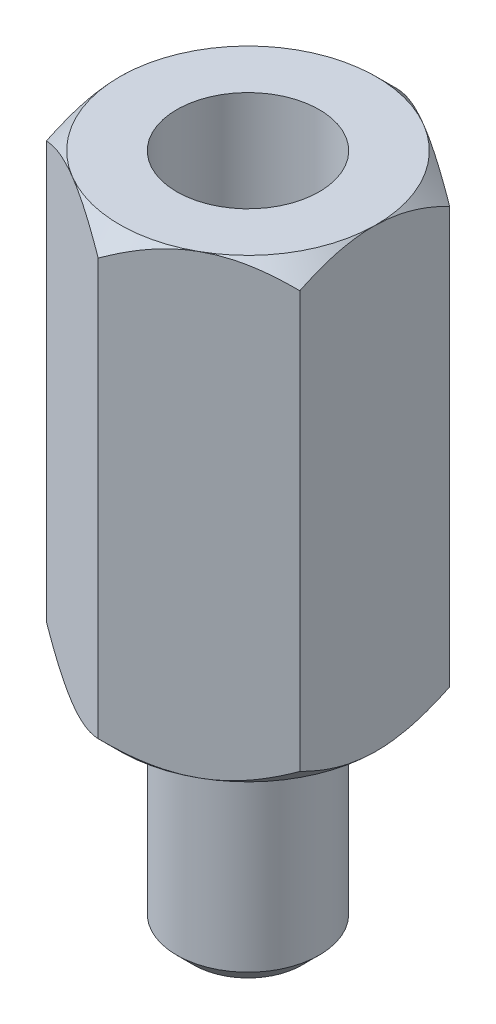
from build123d import *

# Parameters (mm, degrees)
SKETCH1_R           = 1.25
BOSS_EXTRUDE1_DEPTH = 3.9
BOSS_EXTRUDE2_DEPTH = 8
CUT_EXTRUDE1_START  = -4.8
SKETCH3_R           = 1.25
CUT_EXTRUDE1_DEPTH  = 4.8
SKETCH5_OUTSIDE_W   = 36.058
SKETCH5_OUTSIDE_H   = 36.724
SKETCH5_OUTSIDE_R   = 2.25
CUT_EXTRUDE2_DEPTH  = 13.389058311
CUT_EXTRUDE2_DRAFT  = -45
SKETCH6_OUTSIDE_W   = 28.702
SKETCH6_OUTSIDE_H   = 29.368
SKETCH6_OUTSIDE_R   = 2.25
CUT_EXTRUDE3_DEPTH  = 9.710841855
CUT_EXTRUDE3_DRAFT  = -45
CHAMFER1_SIZE       = 0.3


with BuildPart() as part:
    # Sketch1 → Boss-Extrude1 (new body)
    with BuildSketch(Plane(origin=(0, 0, 0), x_dir=(1, 0, 0), z_dir=(0, 1, 0))):
        with Locations(Location((0, 0, 0), (0, 0, 270))):
            Circle(SKETCH1_R)
    extrude(amount=BOSS_EXTRUDE1_DEPTH)

    # Sketch2 → Boss-Extrude2 (add)
    with BuildSketch(Plane(origin=(0, 3.9, 0), x_dir=(1, 0, 0), z_dir=(0, 1, 0))):
        Polygon((2.234821578, -1.324980194), (2.264877297, 1.272922162), (0.030055719, 2.597902356), (-2.234821578, 1.324980194), (-2.264877297, -1.272922162), (-0.030055719, -2.597902356), align=None)
    extrude(amount=BOSS_EXTRUDE2_DEPTH)

    # Sketch3 → Cut-Extrude1 (cut)
    with BuildSketch(Plane(origin=(0, 11.9, 0), x_dir=(1, 0, 0), z_dir=(0, 1, 0)).offset(CUT_EXTRUDE1_START)):
        with Locations(Location((0, 0, 0), (0, 0, 270))):
            Circle(SKETCH3_R)
    extrude(amount=CUT_EXTRUDE1_DEPTH, mode=Mode.SUBTRACT)


with BuildPart() as cut_extrude2_tool:
    # Sketch5 outside → Cut-Extrude2 (with draft: the straight prism first)
    with BuildSketch(Plane(origin=(0, 11.9, 0), x_dir=(1, 0, 0), z_dir=(0, 1, 0))):
        Rectangle(SKETCH5_OUTSIDE_W, SKETCH5_OUTSIDE_H)
        Circle(SKETCH5_OUTSIDE_R, mode=Mode.SUBTRACT)
    extrude(amount=-CUT_EXTRUDE2_DEPTH)
    # Cut-Extrude2: the draft: its side faces are tilted about the plane it starts from
    cut_extrude2_sides = [cut_extrude2_tool.faces().sort_by_distance(p)[0] for p in [
        (0, 5.205470845, 18.362),
        (18.029, 5.205470845, 0),
        (0, 5.205470845, -18.362),
        (-18.029, 5.205470845, 0),
        (-2.25, 5.205470845, 0),
    ]]
    draft(cut_extrude2_sides, Plane(origin=(0, 11.9, 0), x_dir=(1, 0, 0), z_dir=(0, 1, 0)), CUT_EXTRUDE2_DRAFT)


with BuildPart() as part_1:
    add(part.part)

    # Cut-Extrude2: cut by cut_extrude2_tool
    add(cut_extrude2_tool.part, mode=Mode.SUBTRACT)


with BuildPart() as cut_extrude3_tool:
    # Sketch6 outside → Cut-Extrude3 (with draft: the straight prism first)
    with BuildSketch(Plane.XZ.offset(-3.9)):
        Rectangle(SKETCH6_OUTSIDE_W, SKETCH6_OUTSIDE_H)
        Circle(SKETCH6_OUTSIDE_R, mode=Mode.SUBTRACT)
    extrude(amount=-CUT_EXTRUDE3_DEPTH)
    # Cut-Extrude3: the draft: its side faces are tilted about the plane it starts from
    cut_extrude3_sides = [cut_extrude3_tool.faces().sort_by_distance(p)[0] for p in [
        (0, 8.755420928, -14.684),
        (14.351, 8.755420928, 0),
        (0, 8.755420928, 14.684),
        (-14.351, 8.755420928, 0),
        (-2.25, 8.755420928, 0),
    ]]
    draft(cut_extrude3_sides, Plane.XZ.offset(-3.9), CUT_EXTRUDE3_DRAFT)


with BuildPart() as part_2:
    add(part_1.part)

    # Cut-Extrude3: cut by cut_extrude3_tool
    add(cut_extrude3_tool.part, mode=Mode.SUBTRACT)

    # Chamfer1
    chamfer1_edges = [part_2.edges().sort_by_distance(p)[0] for p in [
        (0, 0, -1.25),
    ]]
    chamfer(chamfer1_edges, length=CHAMFER1_SIZE)


solid = part_2.part
